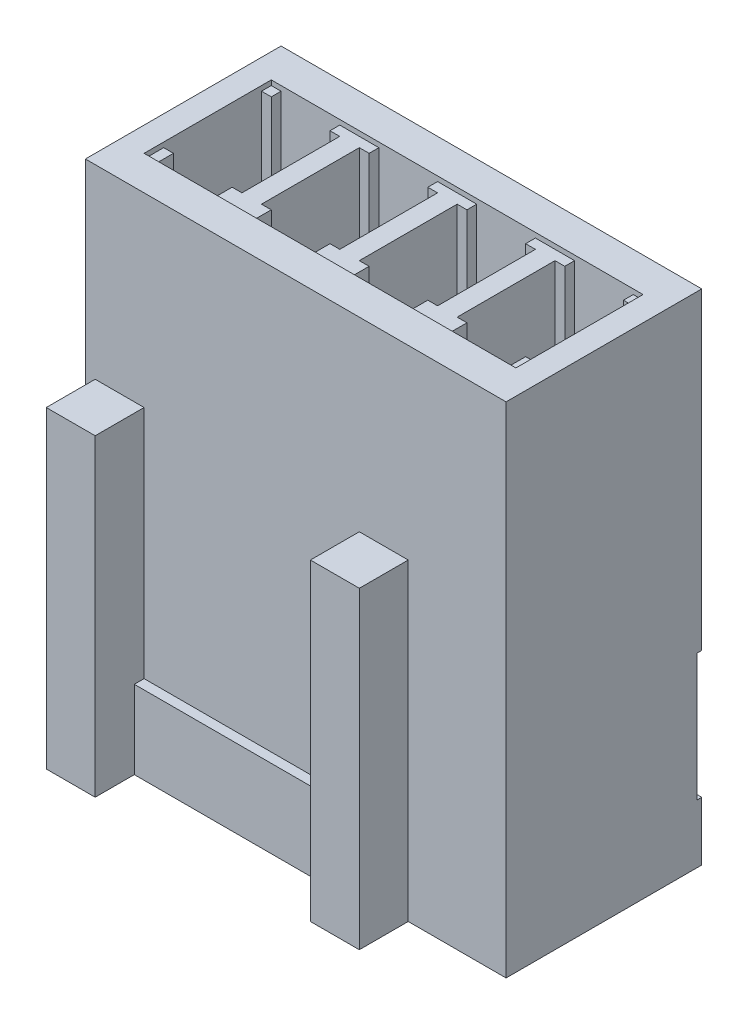
from build123d import *

# Parameters (mm, degrees)
SKIZZE1_W                       = 10.75
SKIZZE1_H                       = 5
AUFSATZ_LINEAR_AUSTRAGEN1_DEPTH = 12.75
SKIZZE2_W                       = 1.25
SKIZZE2_H                       = 1.25
AUFSATZ_LINEAR_AUSTRAGEN2_DEPTH = 8
SKIZZE3_W                       = 5.5
SKIZZE3_H                       = 0.25
AUFSATZ_LINEAR_AUSTRAGEN3_DEPTH = 2
SKIZZE4_W                       = 1.5
SKIZZE4_H                       = 1.5
SCHNITT_LINEAR_AUSTRAGEN2_DEPTH = 15.335816161
FASE1_SIZE                      = 0.25
SCHNITT_LINEAR_AUSTRAGEN3_DEPTH = 12.25
SKIZZE6_W                       = 9.5
SKIZZE6_H                       = 3.25
SCHNITT_LINEAR_AUSTRAGEN4_DEPTH = 0.125
SKIZZE7_W                       = 1.5
SKIZZE7_H                       = 3.25
SCHNITT_LINEAR_AUSTRAGEN5_DEPTH = 1
SKIZZE8_W                       = 10.75
SKIZZE8_H                       = 3.25
SCHNITT_LINEAR_AUSTRAGEN6_DEPTH = 0.125


with BuildPart() as part:
    # Skizze1 → Aufsatz-Linear austragen1 (new body)
    with BuildSketch(Plane(origin=(0, 0, 0), x_dir=(1, 0, 0), z_dir=(0, 1, 0))):
        Rectangle(SKIZZE1_W, SKIZZE1_H)
    extrude(amount=AUFSATZ_LINEAR_AUSTRAGEN1_DEPTH)

    # Skizze2 → Aufsatz-Linear austragen2 (add)
    with BuildSketch(Plane(origin=(0, 0, 0), x_dir=(1, 0, 0), z_dir=(0, 1, 0))):
        with Locations((-4.5, -3.125)):
            Rectangle(SKIZZE2_W, SKIZZE2_H)
        with Locations((2.25, -3.125)):
            Rectangle(SKIZZE2_W, SKIZZE2_H)
    extrude(amount=AUFSATZ_LINEAR_AUSTRAGEN2_DEPTH)

    # Skizze3 → Aufsatz-Linear austragen3 (add)
    with BuildSketch(Plane(origin=(0, 0, 0), x_dir=(1, 0, 0), z_dir=(0, 1, 0))):
        with Locations((-1.125, -2.625)):
            Rectangle(SKIZZE3_W, SKIZZE3_H)
    extrude(amount=AUFSATZ_LINEAR_AUSTRAGEN3_DEPTH)

    # Skizze4 → Schnitt-Linear austragen2 (cut, through all)
    with BuildSketch(Plane(origin=(0, 0, 0), x_dir=(1, 0, 0), z_dir=(0, 1, 0))):
        with Locations((-3.75, -0.875)):
            Rectangle(SKIZZE4_W, SKIZZE4_H)
        with Locations((-1.25, -0.875)):
            Rectangle(SKIZZE4_W, SKIZZE4_H)
        with Locations((1.25, -0.875)):
            Rectangle(SKIZZE4_W, SKIZZE4_H)
        with Locations((3.75, -0.875)):
            Rectangle(SKIZZE4_W, SKIZZE4_H)
    extrude(amount=SCHNITT_LINEAR_AUSTRAGEN2_DEPTH, mode=Mode.SUBTRACT)

    # Fase1
    fase1_edges = [part.edges().sort_by_distance(p)[0] for p in [
        (-4.5, 0, 0.875),
        (-3.75, 0, 1.625),
        (-3, 0, 0.875),
        (-3.75, 0, 0.125),
        (-2, 0, 0.875),
        (-1.25, 0, 1.625),
        (-0.5, 0, 0.875),
        (-1.25, 0, 0.125),
        (0.5, 0, 0.875),
        (1.25, 0, 1.625),
        (2, 0, 0.875),
        (1.25, 0, 0.125),
        (3, 0, 0.875),
        (3.75, 0, 1.625),
        (4.5, 0, 0.875),
        (3.75, 0, 0.125),
    ]]
    chamfer(fase1_edges, length=FASE1_SIZE)

    # Skizze5 → Schnitt-Linear austragen3 (cut)
    with BuildSketch(Plane(origin=(0, 12.75, 0), x_dir=(1, 0, 0), z_dir=(0, 1, 0))):
        Polygon((-4.5, 1.625), (-3, 1.625), (-3, 1.375), (-2.75, 1.375), (-2.75, -1.125), (-3, -1.125), (-3, -1.625), (-4.5, -1.625), (-4.5, -1.125), (-4.75, -1.125), (-4.75, 1.375), (-4.5, 1.375), align=None)
        Polygon((-2, 1.625), (-0.5, 1.625), (-0.5, 1.375), (-0.25, 1.375), (-0.25, -1.125), (-0.5, -1.125), (-0.5, -1.625), (-2, -1.625), (-2, -1.125), (-2.25, -1.125), (-2.25, 1.375), (-2, 1.375), align=None)
        Polygon((0.5, 1.625), (2, 1.625), (2, 1.375), (2.25, 1.375), (2.25, -1.125), (2, -1.125), (2, -1.625), (0.5, -1.625), (0.5, -1.125), (0.25, -1.125), (0.25, 1.375), (0.5, 1.375), align=None)
        Polygon((3, 1.625), (4.5, 1.625), (4.5, 1.375), (4.75, 1.375), (4.75, -1.125), (4.5, -1.125), (4.5, -1.625), (3, -1.625), (3, -1.125), (2.75, -1.125), (2.75, 1.375), (3, 1.375), align=None)
    extrude(amount=-SCHNITT_LINEAR_AUSTRAGEN3_DEPTH, mode=Mode.SUBTRACT)

    # Skizze6 → Schnitt-Linear austragen4 (cut)
    with BuildSketch(Plane(origin=(0, 12.75, 0), x_dir=(1, 0, 0), z_dir=(0, 1, 0))):
        Rectangle(SKIZZE6_W, SKIZZE6_H)
    extrude(amount=-SCHNITT_LINEAR_AUSTRAGEN4_DEPTH, mode=Mode.SUBTRACT)

    # Skizze7 → Schnitt-Linear austragen5 (cut)
    with BuildSketch(Plane(origin=(0, 0, -2.5), x_dir=(-1, 0, 0), z_dir=(0, 0, -1))):
        with Locations((-3.75, 3.125)):
            Rectangle(SKIZZE7_W, SKIZZE7_H)
        with Locations((-1.25, 3.125)):
            Rectangle(SKIZZE7_W, SKIZZE7_H)
        with Locations((1.25, 3.125)):
            Rectangle(SKIZZE7_W, SKIZZE7_H)
        with Locations((3.75, 3.125)):
            Rectangle(SKIZZE7_W, SKIZZE7_H)
    extrude(amount=-SCHNITT_LINEAR_AUSTRAGEN5_DEPTH, mode=Mode.SUBTRACT)

    # Skizze8 → Schnitt-Linear austragen6 (cut)
    with BuildSketch(Plane(origin=(0, 0, -2.5), x_dir=(-1, 0, 0), z_dir=(0, 0, -1))):
        with Locations((0, 3.125)):
            Rectangle(SKIZZE8_W, SKIZZE8_H)
    extrude(amount=-SCHNITT_LINEAR_AUSTRAGEN6_DEPTH, mode=Mode.SUBTRACT)


solid = part.part
